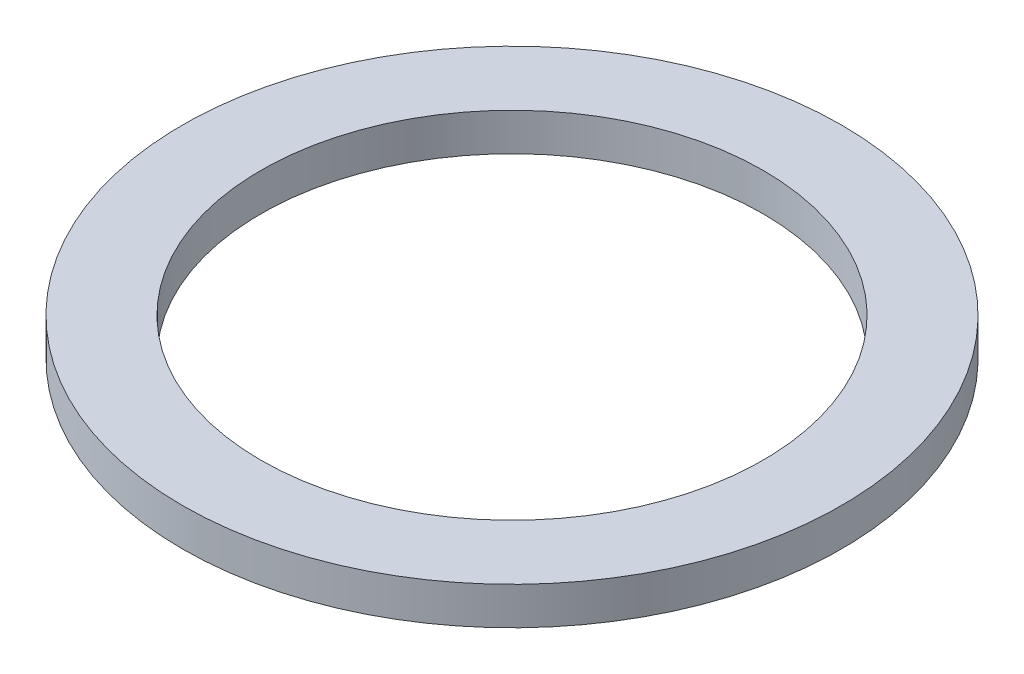
from build123d import *

# Parameters (mm, degrees)
SKETCH_1_R      = 52.5
SKETCH_1_R_2    = 40
EXTRUDE_1_DEPTH = 6


with BuildPart() as part:
    # 草图1 → 凸台-拉伸1 (new body)
    with BuildSketch(Plane(origin=(0, 0, 0), x_dir=(1, 0, 0), z_dir=(0, 1, 0))):
        with Locations(Location((0, 0, 0), (0, 0, 270))):
            Circle(SKETCH_1_R)
        with Locations(Location((0, 0, 0), (0, 0, 270))):
            Circle(SKETCH_1_R_2, mode=Mode.SUBTRACT)
    extrude(amount=EXTRUDE_1_DEPTH)


solid = part.part
